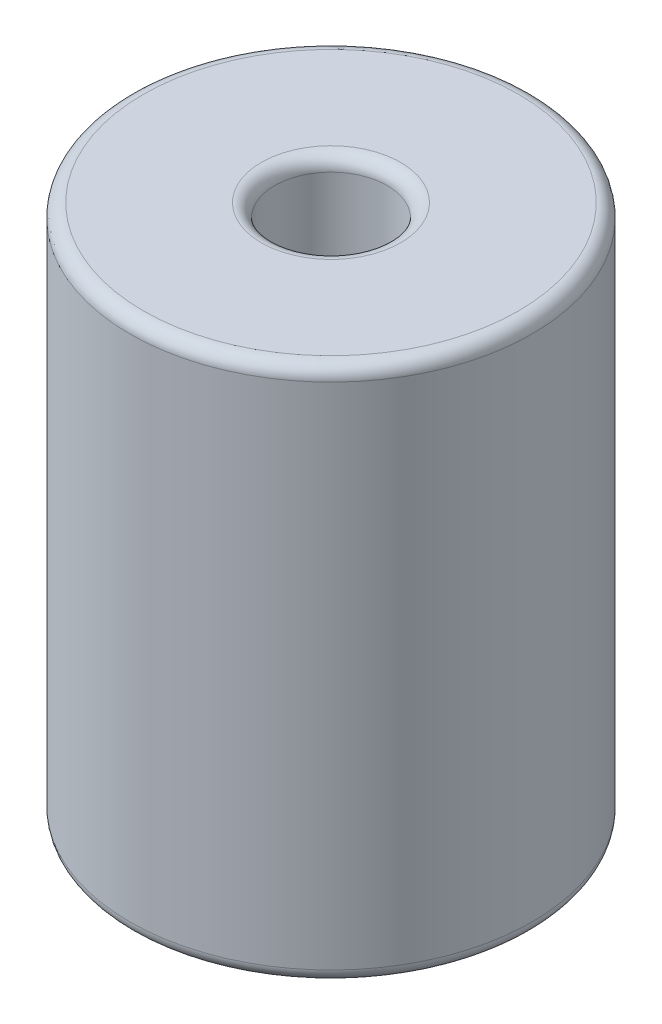
from build123d import *

# Parameters (mm, degrees)
SKETCH1_R           = 7.5
SKETCH1_R_2         = 2.1
BOSS_EXTRUDE1_DEPTH = 20
FILLET1_R           = 0.5


with BuildPart() as part:
    # Sketch1 → Boss-Extrude1 (new body)
    with BuildSketch(Plane(origin=(0, 0, 0), x_dir=(1, 0, 0), z_dir=(0, 1, 0))):
        with Locations(Location((0, 0, 0), (0, 0, 270))):
            Circle(SKETCH1_R)
        with Locations(Location((0, 0, 0), (0, 0, 270))):
            Circle(SKETCH1_R_2, mode=Mode.SUBTRACT)
    extrude(amount=BOSS_EXTRUDE1_DEPTH)

    # Fillet1
    fillet1_edges = [part.edges().sort_by_distance(p)[0] for p in [
        (0, 0, -7.5),
        (0, 20, -7.5),
        (0, 0, -2.1),
        (0, 20, -2.1),
    ]]
    fillet(fillet1_edges, radius=FILLET1_R)


solid = part.part
